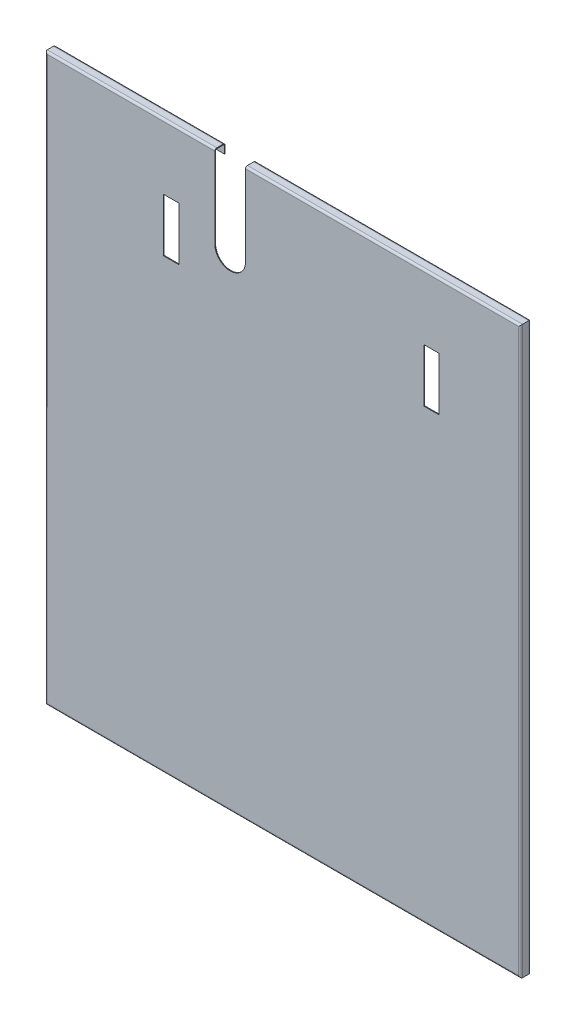
from build123d import *

# Parameters (mm, degrees)
SKETCH_1_W          = 776
SKETCH_1_H          = 924
SKETCH_1_W_2        = 25
SKETCH_1_H_2        = 87
EXTRUDE_1_DEPTH     = 1.2
SKETCH_2_W          = 776
SKETCH_2_H          = 924
SKETCH_2_W_2        = 773.6
SKETCH_2_H_2        = 921.6
EXTRUDE_2_DEPTH     = 15.5
SKETCH_3_W          = 776
SKETCH_3_H          = 924
SKETCH_3_W_2        = 746
SKETCH_3_H_2        = 894
EXTRUDE_3_DEPTH     = 1.2
FILLET_1_R          = 2
FILLET_2_R          = 3.2
FILLET_3_R          = 3.2
CUT_EXTRUDE_1_DEPTH = 1207.743920639


with BuildPart() as part:
    # 스케치1 → 보스-돌출1 (new body)
    with BuildSketch(Plane.XY):
        with Locations((388, 462)):
            Rectangle(SKETCH_1_W, SKETCH_1_H)
        with Locations((205.5, 774.5)):
            Rectangle(SKETCH_1_W_2, SKETCH_1_H_2, mode=Mode.SUBTRACT)
        with Locations((630.5, 774.5)):
            Rectangle(SKETCH_1_W_2, SKETCH_1_H_2, mode=Mode.SUBTRACT)
    extrude(amount=EXTRUDE_1_DEPTH)

    # 스케치2 → 보스-돌출2 (add)
    with BuildSketch(Plane(origin=(0, 0, 0), x_dir=(-1, 0, 0), z_dir=(0, 0, -1))):
        with Locations((-388, 462)):
            Rectangle(SKETCH_2_W, SKETCH_2_H)
        with Locations((-388, 462)):
            Rectangle(SKETCH_2_W_2, SKETCH_2_H_2, mode=Mode.SUBTRACT)
    extrude(amount=EXTRUDE_2_DEPTH)

    # 스케치3 → 보스-돌출3 (add)
    with BuildSketch(Plane(origin=(0, 0, -15.5), x_dir=(-1, 0, 0), z_dir=(0, 0, -1))):
        with Locations((-388, 462)):
            Rectangle(SKETCH_3_W, SKETCH_3_H)
        with Locations((-388, 462)):
            Rectangle(SKETCH_3_W_2, SKETCH_3_H_2, mode=Mode.SUBTRACT)
    extrude(amount=-EXTRUDE_3_DEPTH)

    # 필렛1
    fillet_1_edges = [part.edges().sort_by_distance(p)[0] for p in [
        (1.2, 462, 0),
        (388, 922.8, 0),
        (774.8, 462, 0),
        (388, 1.2, 0),
        (774.8, 1.2, -7.15),
        (1.2, 1.2, -7.15),
        (388, 1.2, -14.3),
        (774.8, 922.8, -7.15),
        (1.2, 922.8, -7.15),
        (1.2, 462, -14.3),
        (388, 922.8, -14.3),
        (774.8, 462, -14.3),
    ]]
    fillet(fillet_1_edges, radius=FILLET_1_R)

    # 필렛2
    fillet_2_edges = [part.edges().sort_by_distance(p)[0] for p in [
        (776, 462, 1.2),
        (388, 924, 1.2),
        (0, 462, 1.2),
        (388, 0, 1.2),
    ]]
    fillet(fillet_2_edges, radius=FILLET_2_R)

    # 필렛3
    fillet_3_edges = [part.edges().sort_by_distance(p)[0] for p in [
        (388, 0, -15.5),
        (0, 462, -15.5),
        (388, 924, -15.5),
        (776, 462, -15.5),
    ]]
    fillet(fillet_3_edges, radius=FILLET_3_R)

    # 스케치4 → 컷-돌출1 (cut, through all)
    with BuildSketch(Plane.XY.offset(1.2)):
        with BuildLine():
            Line((327, 982.257222416), (327, 789))
            ThreePointArc((327, 789), (302, 764), (277, 789))
            Line((277, 789), (277, 982.257222416))
            ThreePointArc((277, 982.257222416), (302, 1007.257222416), (327, 982.257222416))
        make_face()
    extrude(amount=-CUT_EXTRUDE_1_DEPTH, mode=Mode.SUBTRACT)


solid = part.part
